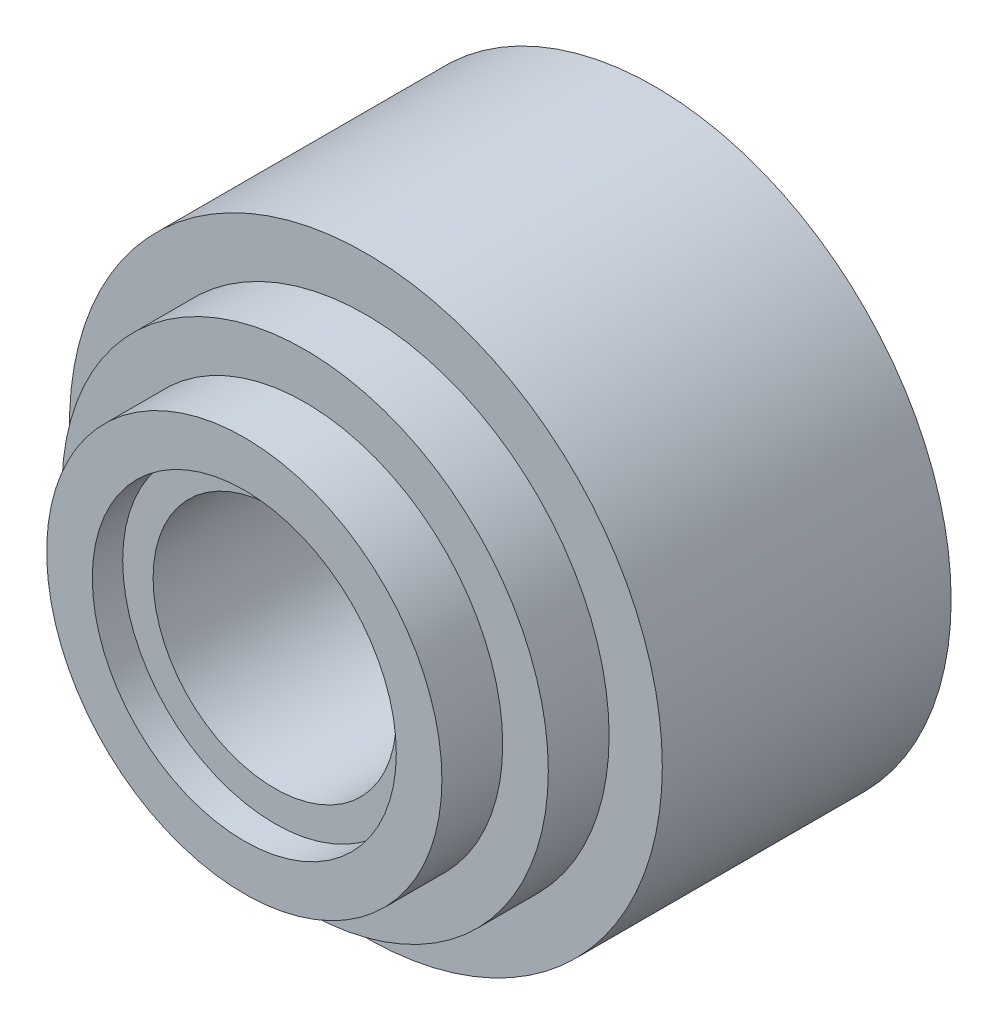
from build123d import *

# Parameters (mm, degrees)
SKETCH_1_R          = 9.75
EXTRUDE_1_DEPTH     = 9.5
SKETCH_2_R          = 8
EXTRUDE_2_DEPTH     = 2
SKETCH_3_R          = 6.5
EXTRUDE_3_DEPTH     = 2
SKETCH_4_R          = 4
CUT_EXTRUDE_1_DEPTH = 20.297020495
SKETCH_5_R          = 5
CUT_EXTRUDE_2_DEPTH = 4
CUT_EXTRUDE_START   = -1
SKETCH_6_R          = 5
CUT_EXTRUDE_3_DEPTH = 1


with BuildPart() as part:
    # 스케치1 → 돌출1 (new body)
    with BuildSketch(Plane.XY):
        Circle(SKETCH_1_R)
    extrude(amount=EXTRUDE_1_DEPTH)

    # 스케치2 → 돌출2 (add)
    with BuildSketch(Plane.XY.offset(9.5)):
        Circle(SKETCH_2_R)
    extrude(amount=EXTRUDE_2_DEPTH)

    # 스케치3 → 돌출3 (add)
    with BuildSketch(Plane.XY.offset(11.5)):
        Circle(SKETCH_3_R)
    extrude(amount=EXTRUDE_3_DEPTH)

    # 스케치4 → 컷-돌출1 (cut, through all)
    with BuildSketch(Plane(origin=(0, 0, 0), x_dir=(-1, 0, 0), z_dir=(0, 0, -1))):
        Circle(SKETCH_4_R)
    extrude(amount=-CUT_EXTRUDE_1_DEPTH, mode=Mode.SUBTRACT)

    # 스케치5 → 컷-돌출2 (cut)
    with BuildSketch(Plane(origin=(0, 0, 0), x_dir=(-1, 0, 0), z_dir=(0, 0, -1))):
        Circle(SKETCH_5_R)
    extrude(amount=-CUT_EXTRUDE_2_DEPTH, mode=Mode.SUBTRACT)

    # 스케치6 → 컷-돌출3 (cut)
    with BuildSketch(Plane.XY.offset(13.5).offset(CUT_EXTRUDE_START)):
        with Locations(Location((0, 0, 0), (0, 0, 180))):
            Circle(SKETCH_6_R)
    extrude(amount=CUT_EXTRUDE_3_DEPTH, mode=Mode.SUBTRACT)


solid = part.part
